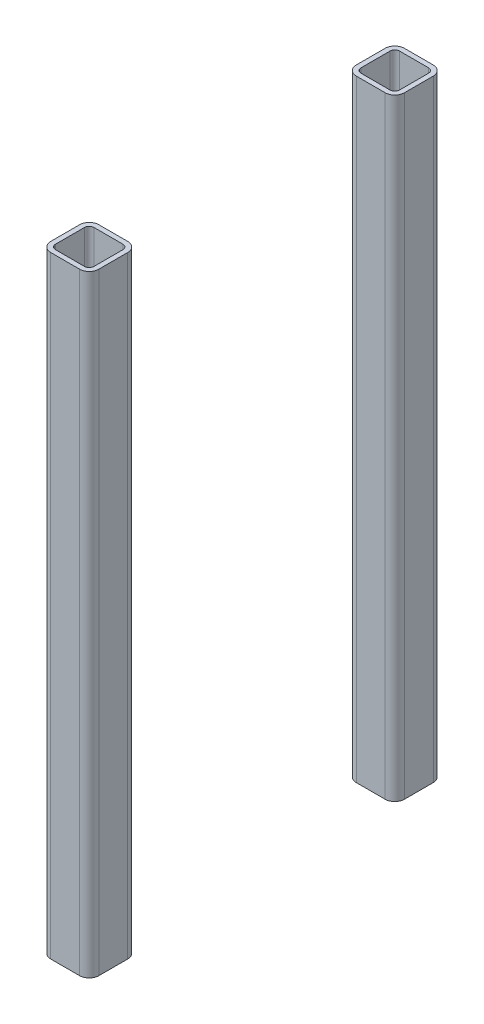
from build123d import *

# Parameters (mm, degrees)
SQUARE_TUBE_40_X_40_X_4_2_DEPTH   = 508.616222313
SQUARE_TUBE_40_X_40_X_4_2_2_DEPTH = 508.616222313


with BuildPart() as part:
    # Sketch13 → Square tube 40 X 40 X 4(2) (new body)
    with BuildSketch(Plane(origin=(0, 0, -254), x_dir=(1, 0, 0), z_dir=(0, -1, 0))):
        with BuildLine():
            Line((-12, -20), (12, -20))
            ThreePointArc((12, -20), (17.656854249, -17.656854249), (20, -12))
            Line((20, -12), (20, 12))
            ThreePointArc((20, 12), (17.656854249, 17.656854249), (12, 20))
            Line((12, 20), (-12, 20))
            ThreePointArc((-12, 20), (-17.656854249, 17.656854249), (-20, 12))
            Line((-20, 12), (-20, -12))
            ThreePointArc((-20, -12), (-17.656854249, -17.656854249), (-12, -20))
        make_face()
        with BuildLine():
            Line((-12, -16), (12, -16))
            ThreePointArc((12, -16), (14.828427125, -14.828427125), (16, -12))
            Line((16, -12), (16, 12))
            ThreePointArc((16, 12), (14.828427125, 14.828427125), (12, 16))
            Line((12, 16), (-12, 16))
            ThreePointArc((-12, 16), (-14.828427125, 14.828427125), (-16, 12))
            Line((-16, 12), (-16, -12))
            ThreePointArc((-16, -12), (-14.828427125, -14.828427125), (-12, -16))
        make_face(mode=Mode.SUBTRACT)
    extrude(amount=SQUARE_TUBE_40_X_40_X_4_2_DEPTH)


with BuildPart() as body_2:
    # Sketch13 on segment 2 (carried to segment 2) → Square tube 40 X 40 X 4_2 2 (new body)
    with BuildSketch(Plane.XZ):
        with BuildLine():
            Line((-12, -20), (12, -20))
            ThreePointArc((12, -20), (17.656854249, -17.656854249), (20, -12))
            Line((20, -12), (20, 12))
            ThreePointArc((20, 12), (17.656854249, 17.656854249), (12, 20))
            Line((12, 20), (-12, 20))
            ThreePointArc((-12, 20), (-17.656854249, 17.656854249), (-20, 12))
            Line((-20, 12), (-20, -12))
            ThreePointArc((-20, -12), (-17.656854249, -17.656854249), (-12, -20))
        make_face()
        with BuildLine():
            Line((-12, -16), (12, -16))
            ThreePointArc((12, -16), (14.828427125, -14.828427125), (16, -12))
            Line((16, -12), (16, 12))
            ThreePointArc((16, 12), (14.828427125, 14.828427125), (12, 16))
            Line((12, 16), (-12, 16))
            ThreePointArc((-12, 16), (-14.828427125, 14.828427125), (-16, 12))
            Line((-16, 12), (-16, -12))
            ThreePointArc((-16, -12), (-14.828427125, -14.828427125), (-12, -16))
        make_face(mode=Mode.SUBTRACT)
    extrude(amount=SQUARE_TUBE_40_X_40_X_4_2_2_DEPTH)


solid = Compound([part.part, body_2.part])
